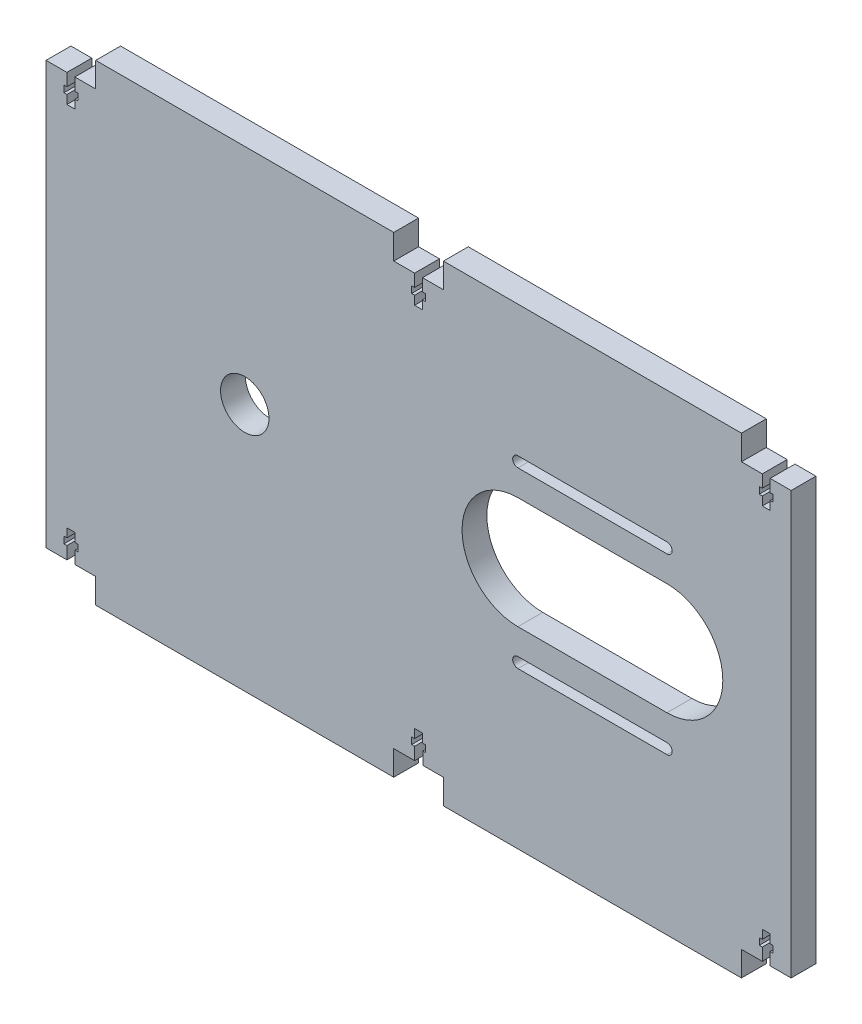
from build123d import *

# Parameters (mm, degrees)
IZIM1_W                     = 300
IZIM1_H                     = 180
IZIM1_R                     = 9.75
Y_KSEKLIK_EKSTR_ZYON1_DEPTH = 10
IZIM2_W                     = 120
IZIM2_H                     = 10
Y_KSEKLIK_EKSTR_ZYON2_DEPTH = 10
IZIM3_W                     = 20
IZIM3_H                     = 10
KES_EKSTR_ZYON1_DEPTH       = 10
IZIM4_W                     = 5.6
IZIM4_H                     = 2.7
KES_EKSTR_ZYON2_DEPTH       = 10
IZIM5_W                     = 3.2
IZIM5_H                     = 3.5
IZIM5_W_2                   = 3.168851203
IZIM5_H_2                   = 5
IZIM5_H_3                   = 5.09138305
IZIM5_W_3                   = 3.157417266
IZIM5_W_4                   = 3.164794192
IZIM5_W_5                   = 3.283155767
IZIM5_W_6                   = 3.292541888
KES_EKSTR_ZYON3_DEPTH       = 10


with BuildPart() as part:
    # Çizim1 → Yükseklik-Ekstrüzyon1 (new body)
    with BuildSketch(Plane.XY):
        Rectangle(IZIM1_W, IZIM1_H)
        with Locations((-70, 10)):
            Circle(IZIM1_R, mode=Mode.SUBTRACT)
        with BuildLine():
            Line((100, -12.5), (40, -12.5))
            ThreePointArc((40, -12.5), (17.5, 10), (40, 32.5))
            Line((40, 32.5), (100, 32.5))
            ThreePointArc((100, 32.5), (122.5, 10), (100, -12.5))
        make_face(mode=Mode.SUBTRACT)
        with BuildLine():
            Line((100, 42.9), (40, 42.9))
            ThreePointArc((40, 42.9), (37.9, 45), (40, 47.1))
            Line((40, 47.1), (100, 47.1))
            ThreePointArc((100, 47.1), (102.1, 45), (100, 42.9))
        make_face(mode=Mode.SUBTRACT)
        with BuildLine():
            Line((100, -27.1), (40, -27.1))
            ThreePointArc((40, -27.1), (37.9, -25), (40, -22.9))
            Line((40, -22.9), (100, -22.9))
            ThreePointArc((100, -22.9), (102.1, -25), (100, -27.1))
        make_face(mode=Mode.SUBTRACT)
    extrude(amount=Y_KSEKLIK_EKSTR_ZYON1_DEPTH)

    # Çizim2 → Yükseklik-Ekstrüzyon2 (add)
    with BuildSketch(Plane(origin=(0, 90, 0), x_dir=(1, 0, 0), z_dir=(0, 1, 0))):
        with Locations((70, -5)):
            Rectangle(IZIM2_W, IZIM2_H)
        with Locations((-70, -5)):
            Rectangle(IZIM2_W, IZIM2_H)
    extrude(amount=Y_KSEKLIK_EKSTR_ZYON2_DEPTH)

    # Çizim3 → Kes-Ekstrüzyon1 (cut)
    with BuildSketch(Plane(origin=(0, -90, 0), x_dir=(-1, 0, 0), z_dir=(0, -1, 0))):
        with Locations((140, -5)):
            Rectangle(IZIM3_W, IZIM3_H)
        with Locations((-140, -5)):
            Rectangle(IZIM3_W, IZIM3_H)
        with Locations((0, -5)):
            Rectangle(IZIM3_W, IZIM3_H)
    extrude(amount=-KES_EKSTR_ZYON1_DEPTH, mode=Mode.SUBTRACT)

    # Çizim4 → Kes-Ekstrüzyon2 (cut)
    with BuildSketch(Plane.XY.offset(10)):
        with Locations((-140, 83.65)):
            Rectangle(IZIM4_W, IZIM4_H)
        with Locations((0, 83.65)):
            Rectangle(IZIM4_W, IZIM4_H)
        with Locations((140, 83.65)):
            Rectangle(IZIM4_W, IZIM4_H)
        with Locations((-140, -73.65)):
            Rectangle(IZIM4_W, IZIM4_H)
        with Locations((0, -73.65)):
            Rectangle(IZIM4_W, IZIM4_H)
        with Locations((140, -73.65)):
            Rectangle(IZIM4_W, IZIM4_H)
    extrude(amount=-KES_EKSTR_ZYON2_DEPTH, mode=Mode.SUBTRACT)

    # Çizim5 → Kes-Ekstrüzyon3 (cut)
    with BuildSketch(Plane.XY.offset(10)):
        with Locations((-140, 80.55)):
            Rectangle(IZIM5_W, IZIM5_H)
        with Locations((0, 80.55)):
            Rectangle(IZIM5_W, IZIM5_H)
        with Locations((140, 80.55)):
            Rectangle(IZIM5_W, IZIM5_H)
        with Locations((-140, -70.55)):
            Rectangle(IZIM5_W, IZIM5_H)
        with Locations((0, -70.55)):
            Rectangle(IZIM5_W, IZIM5_H)
        with Locations((-0.015574398, 87.5)):
            Rectangle(IZIM5_W_2, IZIM5_H_2)
        with Locations((140, -70.55)):
            Rectangle(IZIM5_W, IZIM5_H)
        with Locations((-140, 87.545691525)):
            Rectangle(IZIM5_W, IZIM5_H_3)
        with Locations((139.978708633, 87.5)):
            Rectangle(IZIM5_W_3, IZIM5_H_2)
        with Locations((139.982397096, -77.5)):
            Rectangle(IZIM5_W_4, IZIM5_H_2)
        with Locations((0.041577884, -77.5)):
            Rectangle(IZIM5_W_5, IZIM5_H_2)
        with Locations((-139.953729056, -77.5)):
            Rectangle(IZIM5_W_6, IZIM5_H_2)
    extrude(amount=-KES_EKSTR_ZYON3_DEPTH, mode=Mode.SUBTRACT)


solid = part.part
